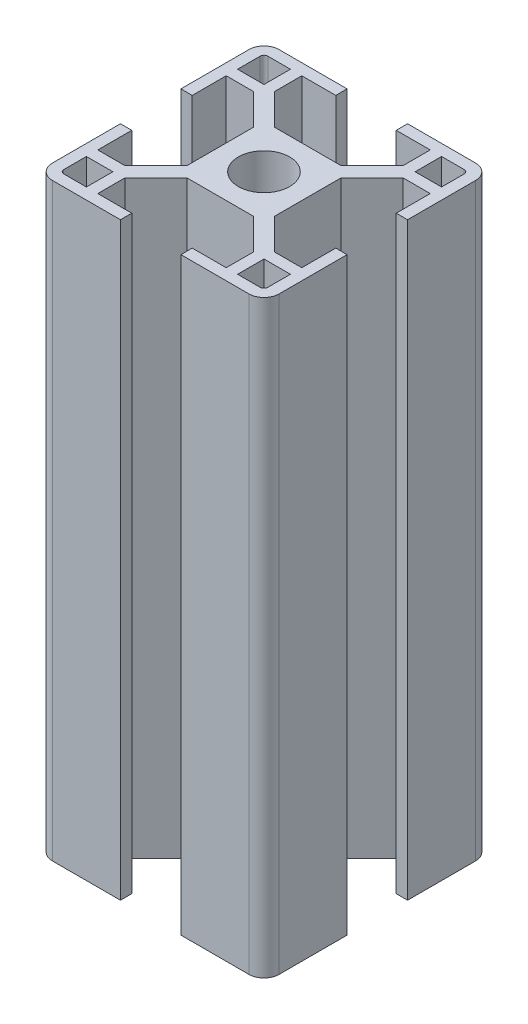
from build123d import *

# Parameters (mm, degrees)
SZKIC2_R                    = 3.4
DODANIE_WYCI_GNI_CIE1_DEPTH = 78


with BuildPart() as part:
    # Szkic2 → Dodanie-wyciągnięcie1 (new body)
    with BuildSketch(Plane(origin=(0, 0, 0), x_dir=(1, 0, 0), z_dir=(0, 1, 0))):
        with BuildLine():
            Line((15.000219073, 4.001445911), (15.000219073, 13.001445911))
            ThreePointArc((15.000219073, 13.001445911), (14.414432635, 14.415659474), (13.000219073, 15.001445911))
            Line((13.000219073, 15.001445911), (4.000219073, 15.001445911))
            Line((4.000219073, 15.001445911), (4.000219073, 13.501445911))
            Line((4.000219073, 13.501445911), (8.500219073, 13.501445911))
            Line((8.500219073, 13.501445911), (8.500219073, 9.915659474))
            Line((8.500219073, 9.915659474), (4.38600551, 5.801445911))
            Line((4.38600551, 5.801445911), (-4.385567365, 5.801445911))
            Line((-4.385567365, 5.801445911), (-8.499780927, 9.915659474))
            Line((-8.499780927, 9.915659474), (-8.499780927, 13.501445911))
            Line((-8.499780927, 13.501445911), (-3.999780927, 13.501445911))
            Line((-3.999780927, 13.501445911), (-3.999780927, 15.001445911))
            Line((-3.999780927, 15.001445911), (-12.999780927, 15.001445911))
            ThreePointArc((-12.999780927, 15.001445911), (-14.41399449, 14.415659474), (-14.999780927, 13.001445911))
            Line((-14.999780927, 13.001445911), (-14.999780927, 4.001445911))
            Line((-14.999780927, 4.001445911), (-13.499780927, 4.001445911))
            Line((-13.499780927, 4.001445911), (-13.499780927, 8.501445911))
            Line((-13.499780927, 8.501445911), (-9.91399449, 8.501445911))
            Line((-9.91399449, 8.501445911), (-5.799780927, 4.387232349))
            Line((-5.799780927, 4.387232349), (-5.799780927, -4.384340526))
            Line((-5.799780927, -4.384340526), (-9.91399449, -8.498554089))
            Line((-9.91399449, -8.498554089), (-13.499780927, -8.498554089))
            Line((-13.499780927, -8.498554089), (-13.499780927, -3.998554089))
            Line((-13.499780927, -3.998554089), (-14.999780927, -3.998554089))
            Line((-14.999780927, -3.998554089), (-14.999780927, -12.998554089))
            ThreePointArc((-14.999780927, -12.998554089), (-14.41399449, -14.412767651), (-12.999780927, -14.998554089))
            Line((-12.999780927, -14.998554089), (-3.999780927, -14.998554089))
            Line((-3.999780927, -14.998554089), (-3.999780927, -13.498554089))
            Line((-3.999780927, -13.498554089), (-8.499780927, -13.498554089))
            Line((-8.499780927, -13.498554089), (-8.499780927, -9.912767651))
            Line((-8.499780927, -9.912767651), (-4.385567365, -5.798554089))
            Line((-4.385567365, -5.798554089), (4.38600551, -5.798554089))
            Line((4.38600551, -5.798554089), (8.500219073, -9.912767651))
            Line((8.500219073, -9.912767651), (8.500219073, -13.498554089))
            Line((8.500219073, -13.498554089), (4.000219073, -13.498554089))
            Line((4.000219073, -13.498554089), (4.000219073, -14.998554089))
            Line((4.000219073, -14.998554089), (13.000219073, -14.998554089))
            ThreePointArc((13.000219073, -14.998554089), (14.414432635, -14.412767651), (15.000219073, -12.998554089))
            Line((15.000219073, -12.998554089), (15.000219073, -3.998554089))
            Line((15.000219073, -3.998554089), (13.500219073, -3.998554089))
            Line((13.500219073, -3.998554089), (13.500219073, -8.498554089))
            Line((13.500219073, -8.498554089), (9.914432635, -8.498554089))
            Line((9.914432635, -8.498554089), (5.800219073, -4.384340526))
            Line((5.800219073, -4.384340526), (5.800219073, 4.387232349))
            Line((5.800219073, 4.387232349), (9.914432635, 8.501445911))
            Line((9.914432635, 8.501445911), (13.500219073, 8.501445911))
            Line((13.500219073, 8.501445911), (13.500219073, 4.001445911))
            Line((13.500219073, 4.001445911), (15.000219073, 4.001445911))
        make_face()
        with Locations(Location((0, 0, 0), (0, 0, 270))):
            Circle(SZKIC2_R, mode=Mode.SUBTRACT)
        with BuildLine():
            Line((10.001445911, -10.000219073), (13.501445911, -10.000219073))
            Line((13.501445911, -10.000219073), (13.501445911, -13.000219073))
            ThreePointArc((13.501445911, -13.000219073), (13.354999302, -13.353772463), (13.001445911, -13.500219073))
            Line((13.001445911, -13.500219073), (10.001445911, -13.500219073))
            Line((10.001445911, -13.500219073), (10.001445911, -10.000219073))
        make_face(mode=Mode.SUBTRACT)
        with BuildLine():
            Line((10.000219073, 10.001445911), (13.500219073, 10.001445911))
            Line((13.500219073, 10.001445911), (13.500219073, 13.001445911))
            ThreePointArc((13.500219073, 13.001445911), (13.353772463, 13.354999302), (13.000219073, 13.501445911))
            Line((13.000219073, 13.501445911), (10.000219073, 13.501445911))
            Line((10.000219073, 13.501445911), (10.000219073, 10.001445911))
        make_face(mode=Mode.SUBTRACT)
        with BuildLine():
            Line((-10.000219073, -10.001445911), (-10.000219073, -13.501445911))
            Line((-10.000219073, -13.501445911), (-13.000219073, -13.501445911))
            ThreePointArc((-13.000219073, -13.501445911), (-13.353772463, -13.354999302), (-13.500219073, -13.001445911))
            Line((-13.500219073, -13.001445911), (-13.500219073, -10.001445911))
            Line((-13.500219073, -10.001445911), (-10.000219073, -10.001445911))
        make_face(mode=Mode.SUBTRACT)
        with BuildLine():
            Line((-10.001445911, 10.000219073), (-13.501445911, 10.000219073))
            Line((-13.501445911, 10.000219073), (-13.501445911, 13.000219073))
            ThreePointArc((-13.501445911, 13.000219073), (-13.354999302, 13.353772463), (-13.001445911, 13.500219073))
            Line((-13.001445911, 13.500219073), (-10.001445911, 13.500219073))
            Line((-10.001445911, 13.500219073), (-10.001445911, 10.000219073))
        make_face(mode=Mode.SUBTRACT)
    extrude(amount=DODANIE_WYCI_GNI_CIE1_DEPTH)


solid = part.part
